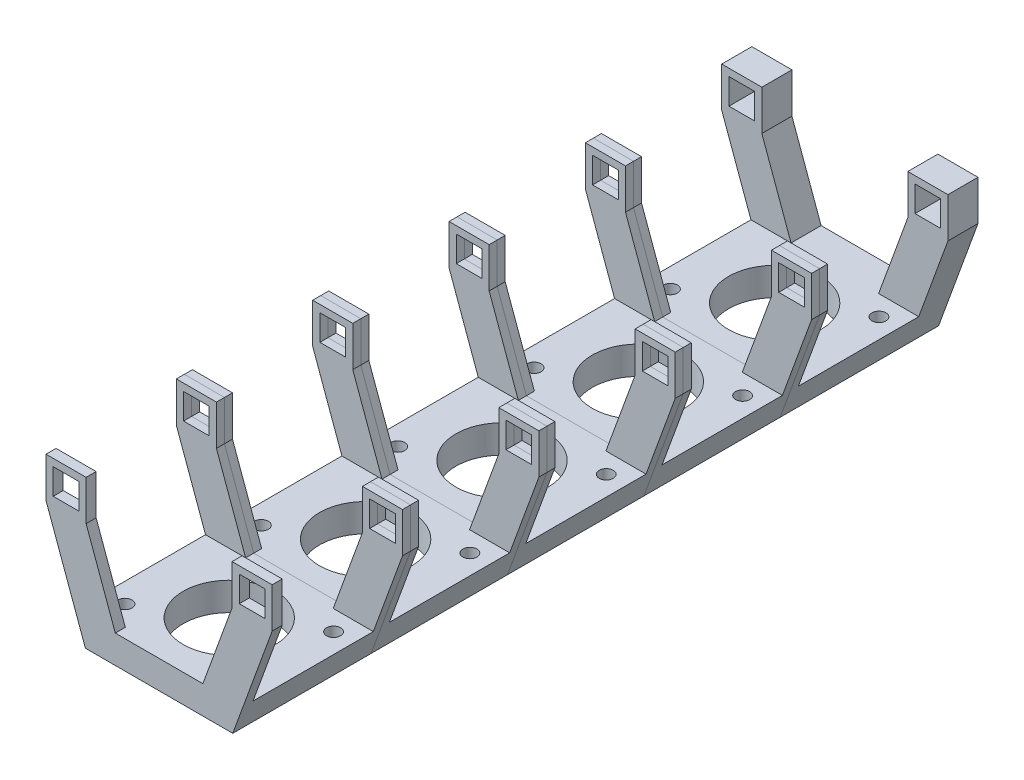
from build123d import *

# Parameters (mm, degrees)
SKETCH3_W           = 6.4
SKETCH3_H           = 6.4
BOSS_EXTRUDE1_DEPTH = 2
BOSS_EXTRUDE2_DEPTH = 30
SKETCH4_W           = 6.4
SKETCH4_H           = 6.4
BOSS_EXTRUDE6_DEPTH = 2
LPATTERN7_COUNT     = 5
LPATTERN7_PITCH     = 34
SKETCH12_W          = 6.4
SKETCH12_H          = 6.4
BOSS_EXTRUDE7_DEPTH = 2
SKETCH13_W          = 6.4
SKETCH13_H          = 6.4
BOSS_EXTRUDE8_DEPTH = 2
SKETCH15_R          = 11.5
SKETCH15_R_2        = 1.75
CUT_EXTRUDE5_DEPTH  = 7
LPATTERN8_COUNT     = 5
LPATTERN8_PITCH     = 34
CUT_EXTRUDE6_DEPTH  = 1.5
SKETCH18_W          = 6.4
SKETCH18_H          = 6.4
BOSS_EXTRUDE9_DEPTH = 3.5


with BuildPart() as part:
    # Sketch3 → Boss-Extrude1 (new body)
    # profile 1 of 3: a face of its own
    with BuildSketch(Plane.XY):
        Polygon((5, 5), (-5, 5), (-5, -5), (2.279404685, -25), (12.279404685, -25), (5, -5), align=None)
        Rectangle(SKETCH3_W, SKETCH3_H, mode=Mode.SUBTRACT)
    # profile 2 of 3: a face of its own
    with BuildSketch(Plane.XY):
        Polygon((41.4, -5), (34.120595315, -25), (44.120595315, -25), (51.4, -5), (51.4, 5), (41.4, 5), align=None)
        with Locations((46.4, 0)):
            Rectangle(SKETCH3_W, SKETCH3_H, mode=Mode.SUBTRACT)
    # profile 3 of 3: a face of its own
    with BuildSketch(Plane.XY):
        Polygon((12.279404685, -25), (2.279404685, -25), (4.827196325, -32), (41.572803675, -32), (44.120595315, -25), (34.120595315, -25), align=None)
    extrude(amount=BOSS_EXTRUDE1_DEPTH)

    # Sketch3<4> → Boss-Extrude2 (add)
    with BuildSketch(Plane.XY):
        Polygon((12.279404685, -25), (2.279404685, -25), (4.827196325, -32), (41.572803675, -32), (44.120595315, -25), (34.120595315, -25), align=None)
    extrude(amount=-BOSS_EXTRUDE2_DEPTH)

    # Sketch4 → Boss-Extrude6 (add)
    with BuildSketch(Plane(origin=(0, 0, -30), x_dir=(-1, 0, 0), z_dir=(0, 0, -1))):
        Polygon((5, -5), (5, 5), (-5, 5), (-5, -5), (-12.279404685, -25), (-34.120595315, -25), (-41.4, -5), (-41.4, 5), (-51.4, 5), (-51.4, -5), (-44.120595315, -25), (-41.572803675, -32), (-4.827196325, -32), (-2.279404685, -25), align=None)
        Rectangle(SKETCH4_W, SKETCH4_H, mode=Mode.SUBTRACT)
        with Locations((-46.4, 0)):
            Rectangle(SKETCH4_W, SKETCH4_H, mode=Mode.SUBTRACT)
    extrude(amount=BOSS_EXTRUDE6_DEPTH)


with BuildPart() as lpattern7_1:
    # LPattern7: pattern copy
    add(part.part.moved(Location(Vector(0, 0, 1) * (1 * LPATTERN7_PITCH))))


with BuildPart() as lpattern7_2:
    # LPattern7: pattern copy
    add(part.part.moved(Location(Vector(0, 0, 1) * (2 * LPATTERN7_PITCH))))


with BuildPart() as lpattern7_3:
    # LPattern7: pattern copy
    add(part.part.moved(Location(Vector(0, 0, 1) * (3 * LPATTERN7_PITCH))))


with BuildPart() as lpattern7_4:
    # LPattern7: pattern copy
    add(part.part.moved(Location(Vector(0, 0, 1) * (4 * LPATTERN7_PITCH))))

    # Sketch13 → Boss-Extrude8 (add)
    with BuildSketch(Plane.XY.offset(138)):
        Polygon((41.4, -5), (41.4, 5), (51.4, 5), (51.4, -5), (41.572803675, -32), (4.827196325, -32), (-5, -5), (-5, 5), (5, 5), (5, -5), (12.279404685, -25), (34.120595315, -25), align=None)
        with Locations((46.4, 0)):
            Rectangle(SKETCH13_W, SKETCH13_H, mode=Mode.SUBTRACT)
        Rectangle(SKETCH13_W, SKETCH13_H, mode=Mode.SUBTRACT)
    extrude(amount=BOSS_EXTRUDE8_DEPTH)

    # Sketch15 → Cut-Extrude5 (cut)
    with BuildSketch(Plane(origin=(0, -25, 0), x_dir=(1, 0, 0), z_dir=(0, 1, 0))):
        with Locations(Location((23.2, -121, 0), (0, 0, 270))):
            Circle(SKETCH15_R)
        with Locations(Location((7.2, -131, 0), (0, 0, 270))):
            Circle(SKETCH15_R_2)
        with Locations(Location((39.2, -111, 0), (0, 0, 270))):
            Circle(SKETCH15_R_2)
    cut_extrude5 = extrude(amount=-CUT_EXTRUDE5_DEPTH, mode=Mode.SUBTRACT)

    # Sketch17 → Cut-Extrude6 (cut)
    with BuildSketch(Plane.XY.offset(140)):
        Polygon((-5, 5), (5, 5), (5, -5), (12.279404685, -25), (34.120595315, -25), (41.4, -5), (41.4, 5), (51.4, 5), (51.4, -5), (41.572803675, -32), (4.827196325, -32), (-5, -5), align=None)
    extrude(amount=-CUT_EXTRUDE6_DEPTH, mode=Mode.SUBTRACT)


with BuildPart() as part_1:
    add(part.part)

    # Sketch12 → Boss-Extrude7 (add)
    with BuildSketch(Plane(origin=(0, 0, -32), x_dir=(-1, 0, 0), z_dir=(0, 0, -1))):
        Polygon((-5, 5), (-5, -5), (-12.279404685, -25), (-34.120595315, -25), (-41.4, -5), (-41.4, 5), (-51.4, 5), (-51.4, -5), (-41.572803675, -32), (-4.827196325, -32), (5, -5), (5, 5), align=None)
        Rectangle(SKETCH12_W, SKETCH12_H, mode=Mode.SUBTRACT)
        with Locations((-46.4, 0)):
            Rectangle(SKETCH12_W, SKETCH12_H, mode=Mode.SUBTRACT)
    extrude(amount=BOSS_EXTRUDE7_DEPTH)


with BuildPart() as lpattern8_tool:
    # LPattern8: Cut-Extrude5 ×5
    with Locations(*[(0, 0, -i * LPATTERN8_PITCH) for i in range(1, LPATTERN8_COUNT)]):
        add(cut_extrude5)


with BuildPart() as part_2:
    add(part_1.part)

    # LPattern8: cut by lpattern8_tool
    add(lpattern8_tool.part, mode=Mode.SUBTRACT)

    # Sketch18 → Boss-Extrude9 (add)
    with BuildSketch(Plane(origin=(0, 0, -34), x_dir=(-1, 0, 0), z_dir=(0, 0, -1))):
        Polygon((5, -5), (5, 5), (-5, 5), (-5, -5), (-12.279404685, -25), (-34.120595315, -25), (-41.4, -5), (-41.4, 5), (-51.4, 5), (-51.4, -5), (-41.572803675, -32), (-4.827196325, -32), align=None)
        Rectangle(SKETCH18_W, SKETCH18_H, mode=Mode.SUBTRACT)
        with Locations((-46.4, 0)):
            Rectangle(SKETCH18_W, SKETCH18_H, mode=Mode.SUBTRACT)
    extrude(amount=BOSS_EXTRUDE9_DEPTH)


with BuildPart() as lpattern7_1_1:
    add(lpattern7_1.part)

    # LPattern8: cut by lpattern8_tool
    add(lpattern8_tool.part, mode=Mode.SUBTRACT)


with BuildPart() as lpattern7_2_1:
    add(lpattern7_2.part)

    # LPattern8: cut by lpattern8_tool
    add(lpattern8_tool.part, mode=Mode.SUBTRACT)


with BuildPart() as lpattern7_3_1:
    add(lpattern7_3.part)

    # LPattern8: cut by lpattern8_tool
    add(lpattern8_tool.part, mode=Mode.SUBTRACT)


solid = Compound([lpattern7_4.part, part_2.part, lpattern7_1_1.part, lpattern7_2_1.part, lpattern7_3_1.part])
